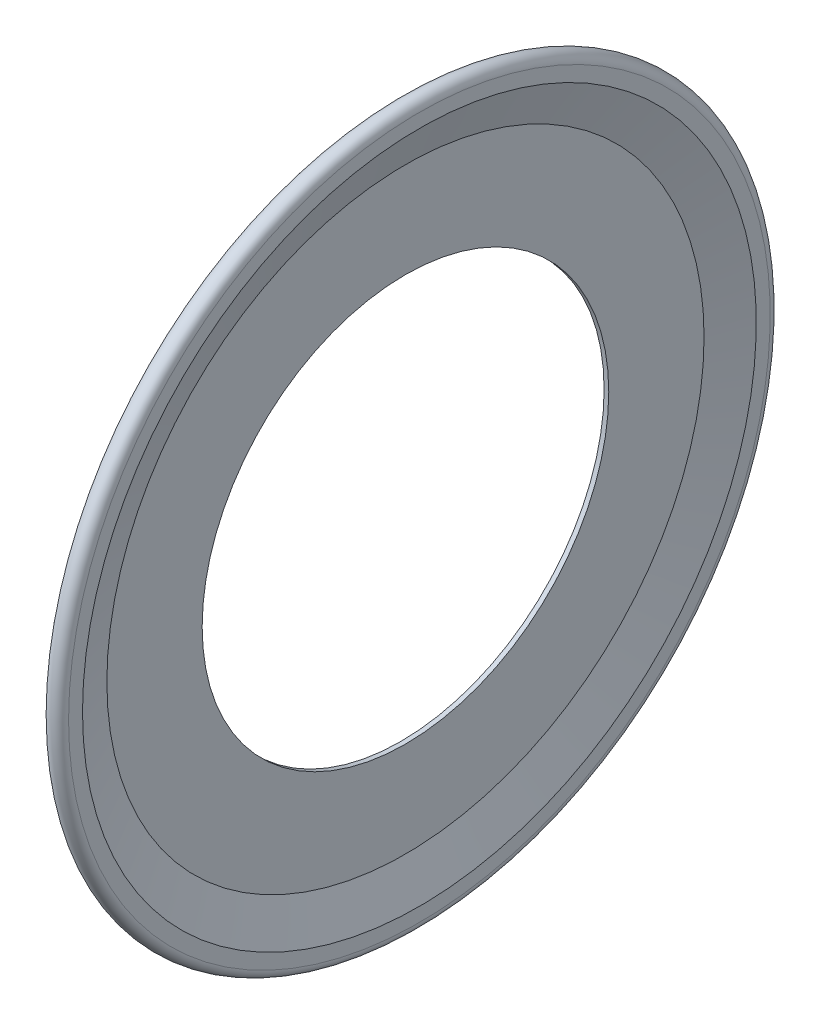
from build123d import *


with BuildPart() as part:
    # Sketch1 → Revolve1 (revolve)
    with BuildSketch(Plane.XY, mode=Mode.PRIVATE) as revolve1_sk:
        with BuildLine():
            Line((-5.8, 9), (-5.8, 8.75))
            Line((-5.8, 8.75), (-5.6, 8.75))
            Line((-5.6, 8.75), (-5.6, 9))
            Line((-5.6, 9), (-5.6, 12.851513548))
            Line((-5.6, 12.851513548), (-5, 14.5))
            Line((-5, 14.5), (-5, 15.1))
            ThreePointArc((-5, 15.1), (-5.4, 15.5), (-5.8, 15.1))
            Line((-5.8, 15.1), (-5.8, 14.5))
            Line((-5.8, 14.5), (-5.6, 14.5))
            Line((-5.6, 14.5), (-5.6, 15.1))
            ThreePointArc((-5.6, 15.1), (-5.4, 15.3), (-5.2, 15.1))
            Line((-5.2, 15.1), (-5.2, 14.535265396))
            Line((-5.2, 14.535265396), (-5.8, 12.886778944))
            Line((-5.8, 12.886778944), (-5.8, 9))
        make_face()
    revolve(revolve1_sk.sketch.rotate(Axis((-6, 0, 0), (1, 0, 0)), 90), axis=Axis((-6, 0, 0), (1, 0, 0)))


solid = part.part
